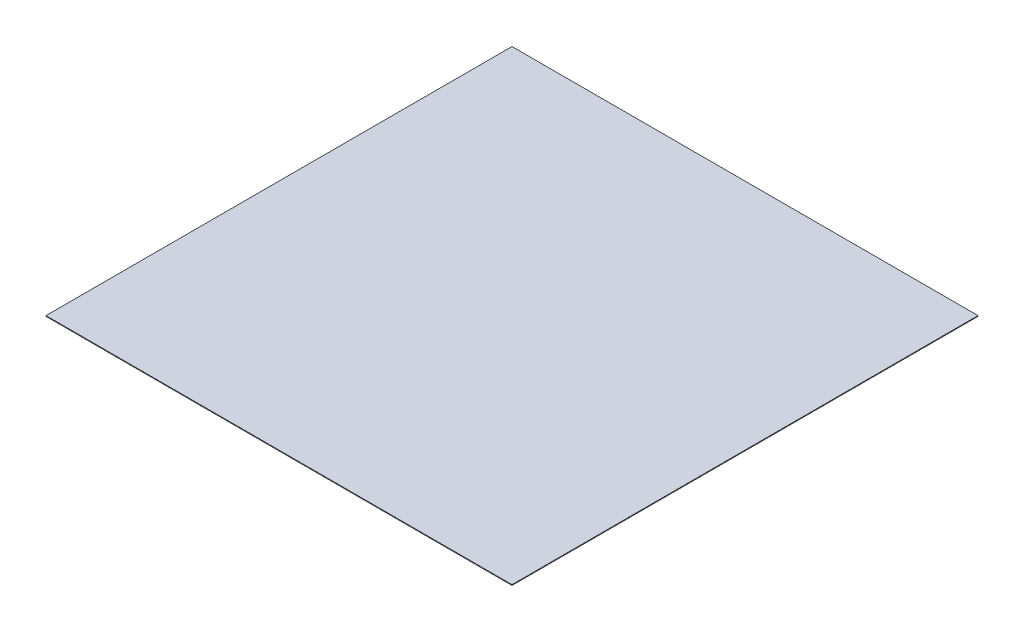
from build123d import *

# Parameters (mm, degrees)
SKETCH1_W           = 1325
SKETCH1_H           = 1325
BOSS_EXTRUDE1_DEPTH = 2


with BuildPart() as part:
    # Sketch1 → Boss-Extrude1 (new body)
    with BuildSketch(Plane(origin=(0, 0, 0), x_dir=(1, 0, 0), z_dir=(0, 1, 0))):
        Rectangle(SKETCH1_W, SKETCH1_H)
    extrude(amount=BOSS_EXTRUDE1_DEPTH)


solid = part.part
